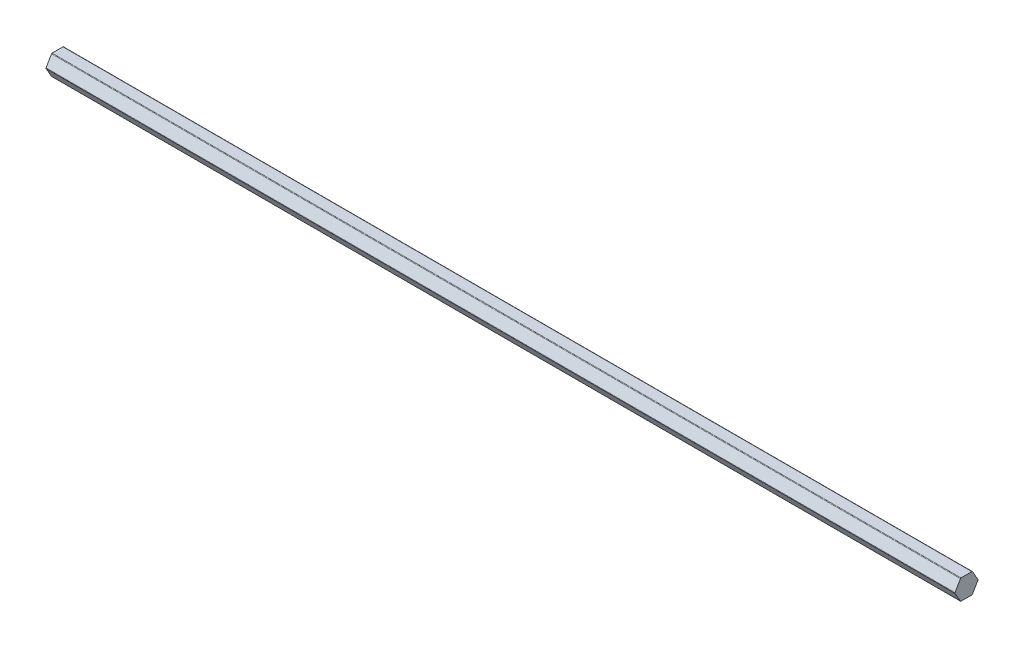
from build123d import *

# Parameters (mm, degrees)
BOSS_EXTRUDE1_DEPTH = 285.75


with BuildPart() as part:
    # Sketch1 → Boss-Extrude1 (new, symmetric)
    with BuildSketch(Plane(origin=(0, 0, 0), x_dir=(0, 0, -1), z_dir=(1, 0, 0))):
        with BuildLine():
            Line((7.188010851, 0.25), (3.810511777, 6.1))
            ThreePointArc((3.810511777, 6.1), (3.627499075, 6.283012702), (3.377499075, 6.35))
            Line((3.377499075, 6.35), (-3.377499075, 6.35))
            ThreePointArc((-3.377499075, 6.35), (-3.627499075, 6.283012702), (-3.810511777, 6.1))
            Line((-3.810511777, 6.1), (-7.188010851, 0.25))
            ThreePointArc((-7.188010851, 0.25), (-7.25499815, 0), (-7.188010851, -0.25))
            Line((-7.188010851, -0.25), (-3.810511777, -6.1))
            ThreePointArc((-3.810511777, -6.1), (-3.627499075, -6.283012702), (-3.377499075, -6.35))
            Line((-3.377499075, -6.35), (3.377499075, -6.35))
            ThreePointArc((3.377499075, -6.35), (3.627499075, -6.283012702), (3.810511777, -6.1))
            Line((3.810511777, -6.1), (7.188010851, -0.25))
            ThreePointArc((7.188010851, -0.25), (7.25499815, 0), (7.188010851, 0.25))
        make_face()
    extrude(amount=BOSS_EXTRUDE1_DEPTH, both=True)


solid = part.part
